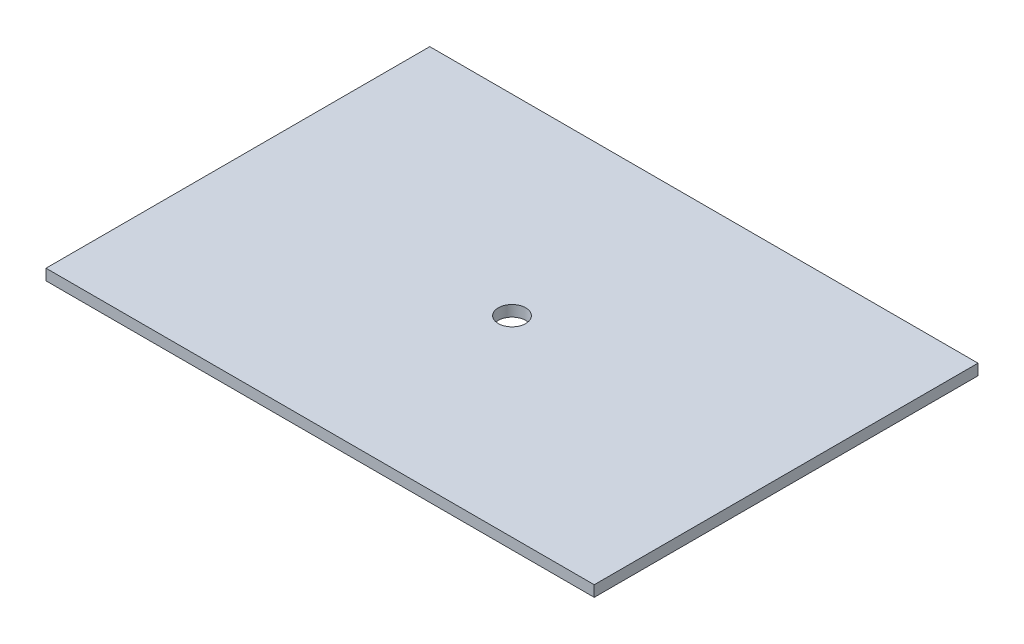
from build123d import *

# Parameters (mm, degrees)
SKETCH1_W           = 127
SKETCH1_H           = 88.9
SKETCH1_R           = 3.175
BOSS_EXTRUDE1_DEPTH = 2.54


with BuildPart() as part:
    # Sketch1 → Boss-Extrude1 (new body)
    with BuildSketch(Plane(origin=(0, 0, 0), x_dir=(1, 0, 0), z_dir=(0, 1, 0))):
        with Locations((-63.5, 44.45)):
            Rectangle(SKETCH1_W, SKETCH1_H)
        with Locations(Location((-63.5, 44.45, 0), (0, 0, 270))):
            Circle(SKETCH1_R, mode=Mode.SUBTRACT)
    extrude(amount=BOSS_EXTRUDE1_DEPTH)


solid = part.part
